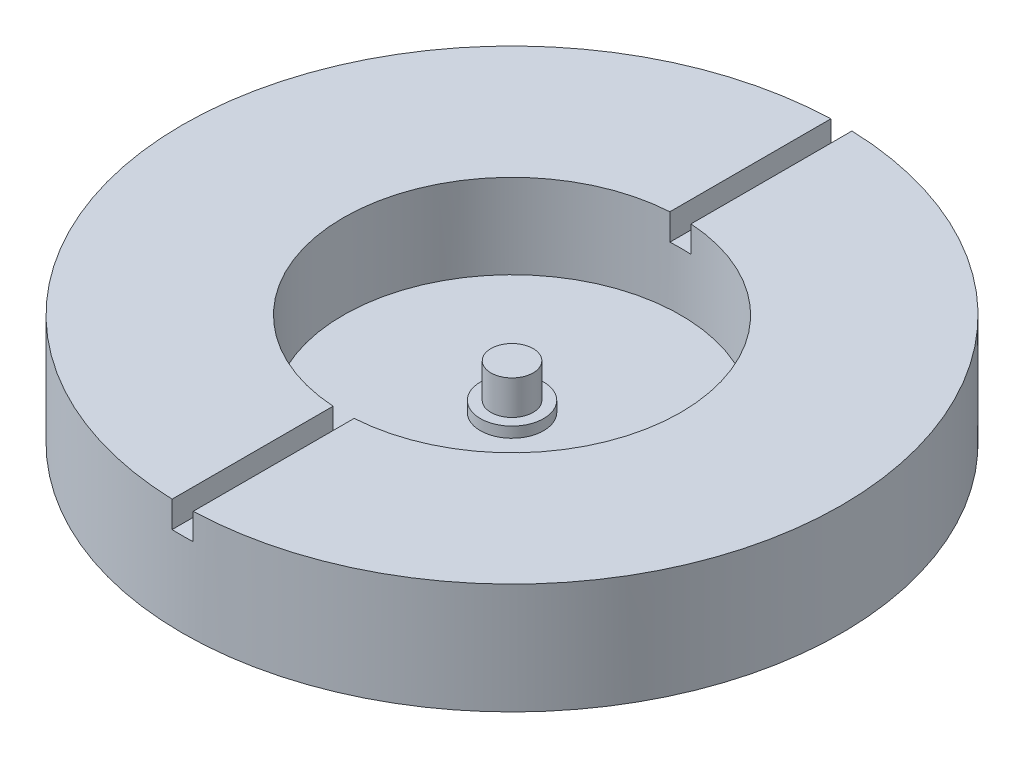
from build123d import *

# Parameters (mm, degrees)
SKETCH1_R           = 62.5
BOSS_EXTRUDE1_DEPTH = 21
SKETCH2_R           = 32
SKETCH2_R_2         = 6
CUT_EXTRUDE1_DEPTH  = 16
SKETCH3_R           = 6
SKETCH3_R_2         = 4
CUT_EXTRUDE2_DEPTH  = 14
SKETCH4_R           = 4
CUT_EXTRUDE3_DEPTH  = 7.5
CUT_EXTRUDE4_START  = -5
CUT_EXTRUDE4_DEPTH  = 5


with BuildPart() as part:
    # Sketch1 → Boss-Extrude1 (new body)
    with BuildSketch(Plane(origin=(0, 0, 0), x_dir=(1, 0, 0), z_dir=(0, 1, 0))):
        with Locations(Location((0, 0, 0), (0, 0, 90))):
            Circle(SKETCH1_R)
    extrude(amount=BOSS_EXTRUDE1_DEPTH)

    # Sketch2 → Cut-Extrude1 (cut)
    with BuildSketch(Plane(origin=(0, 21, 0), x_dir=(1, 0, 0), z_dir=(0, 1, 0))):
        with Locations(Location((0, 0, 0), (0, 0, 270))):
            Circle(SKETCH2_R)
        with Locations(Location((0, 0, 0), (0, 0, 270))):
            Circle(SKETCH2_R_2, mode=Mode.SUBTRACT)
    extrude(amount=-CUT_EXTRUDE1_DEPTH, mode=Mode.SUBTRACT)

    # Sketch3 → Cut-Extrude2 (cut)
    with BuildSketch(Plane(origin=(0, 21, 0), x_dir=(1, 0, 0), z_dir=(0, 1, 0))):
        with Locations(Location((0, 0, 0), (0, 0, 270))):
            Circle(SKETCH3_R)
        with Locations(Location((0, 0, 0), (0, 0, 270))):
            Circle(SKETCH3_R_2, mode=Mode.SUBTRACT)
    extrude(amount=-CUT_EXTRUDE2_DEPTH, mode=Mode.SUBTRACT)

    # Sketch4 → Cut-Extrude3 (cut)
    with BuildSketch(Plane(origin=(0, 21, 0), x_dir=(1, 0, 0), z_dir=(0, 1, 0))):
        with Locations(Location((0, 0, 0), (0, 0, 270))):
            Circle(SKETCH4_R)
    extrude(amount=-CUT_EXTRUDE3_DEPTH, mode=Mode.SUBTRACT)

    # Sketch5 → Cut-Extrude4 (cut)
    with BuildSketch(Plane(origin=(0, 21, 0), x_dir=(1, 0, 0), z_dir=(0, 1, 0)).offset(CUT_EXTRUDE4_START)):
        with BuildLine():
            Line((2, 62.467991804), (2, -62.467991804))
            ThreePointArc((2, -62.467991804), (0, -62.5), (-2, -62.467991804))
            Line((-2, -62.467991804), (-2, 62.467991804))
            ThreePointArc((-2, 62.467991804), (0, 62.5), (2, 62.467991804))
        make_face()
    extrude(amount=CUT_EXTRUDE4_DEPTH, mode=Mode.SUBTRACT)


solid = part.part
